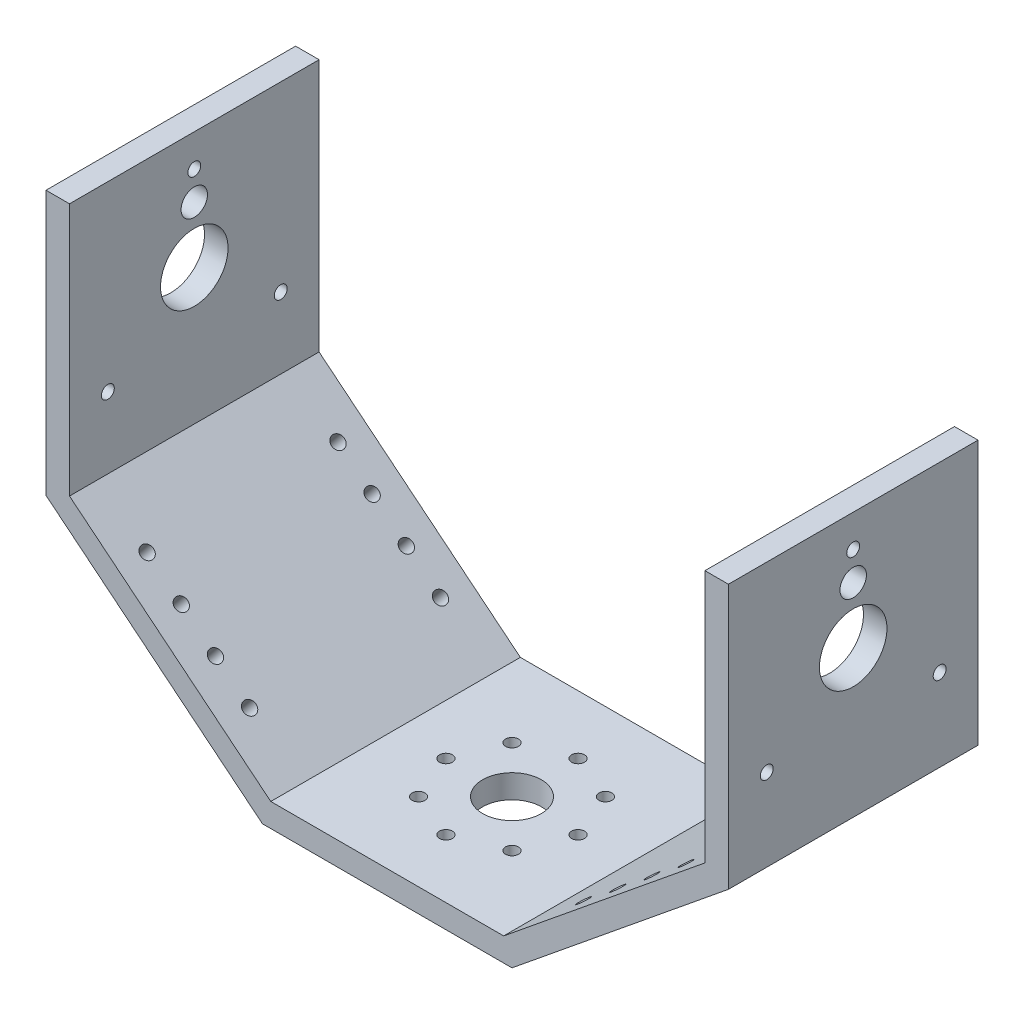
from build123d import *

# Parameters (mm, degrees)
SKETCH1_W           = 232.4
SKETCH1_H           = 85
BOSS_EXTRUDE1_DEPTH = 150
CUT_EXTRUDE1_DEPTH  = 150
CUT_EXTRUDE2_DEPTH  = 150
SKETCH4_R           = 11.5
SKETCH4_R_2         = 2.2
SKETCH4_R_3         = 4.5
CUT_EXTRUDE3_DEPTH  = 280.849977667
SKETCH5_R           = 10
SKETCH5_R_2         = 2.2
CUT_EXTRUDE4_DEPTH  = 189.341949655
SKETCH6_R           = 2.2
CUT_EXTRUDE5_DEPTH  = 221.699143461


with BuildPart() as part:
    # Sketch1 → Boss-Extrude1 (new body)
    with BuildSketch(Plane(origin=(0, 0, 0), x_dir=(1, 0, 0), z_dir=(0, 1, 0))):
        Rectangle(SKETCH1_W, SKETCH1_H)
    extrude(amount=BOSS_EXTRUDE1_DEPTH)

    # Sketch2 → Cut-Extrude1 (cut)
    with BuildSketch(Plane.XY.offset(42.5)):
        Polygon((-116.2, 0), (-116.2, 60), (-42.5, 0), align=None)
        Polygon((116.2, 60), (42.5, 0), (116.2, 0), align=None)
    extrude(amount=-CUT_EXTRUDE1_DEPTH, mode=Mode.SUBTRACT)

    # Sketch3 → Cut-Extrude2 (cut)
    with BuildSketch(Plane.XY.offset(42.5)):
        Polygon((-108.2, 142), (-108.2, 150), (108.2, 150), (108.2, 142), (108.2, 63.803007219), (39.655306133, 8), (-39.655306133, 8), (-108.2, 63.803007219), align=None)
    extrude(amount=-CUT_EXTRUDE2_DEPTH, mode=Mode.SUBTRACT)

    # Sketch4 → Cut-Extrude3 (cut, through all)
    with BuildSketch(Plane.ZY.offset(116.2)):
        with Locations((0, 110)):
            Circle(SKETCH4_R)
        with Locations((0, 139)):
            Circle(SKETCH4_R_2)
        with Locations((0, 129.25)):
            Circle(SKETCH4_R_3)
        with Locations((29.444863729, 88)):
            Circle(SKETCH4_R_2)
        with Locations((-29.444863729, 88)):
            Circle(SKETCH4_R_2)
    extrude(amount=-CUT_EXTRUDE3_DEPTH, mode=Mode.SUBTRACT)

    # Sketch5 → Cut-Extrude4 (cut, through all)
    with BuildSketch(Plane(origin=(0, 8, 0), x_dir=(1, 0, 0), z_dir=(0, 1, 0))):
        with Locations(Location((0, 0, 0), (0, 0, 270))):
            Circle(SKETCH5_R)
        with Locations(Location((0, 22.5, 0), (0, 0, 270))):
            Circle(SKETCH5_R_2)
        with Locations(Location((15.909902577, 15.909902577, 0), (0, 0, 270))):
            Circle(SKETCH5_R_2)
        with Locations(Location((22.5, 0, 0), (0, 0, 270))):
            Circle(SKETCH5_R_2)
        with Locations(Location((15.909902577, -15.909902577, 0), (0, 0, 270))):
            Circle(SKETCH5_R_2)
        with Locations(Location((0, -22.5, 0), (0, 0, 270))):
            Circle(SKETCH5_R_2)
        with Locations(Location((-15.909902577, -15.909902577, 0), (0, 0, 270))):
            Circle(SKETCH5_R_2)
        with Locations(Location((-22.5, 0, 0), (0, 0, 270))):
            Circle(SKETCH5_R_2)
        with Locations(Location((-15.909902577, 15.909902577, 0), (0, 0, 270))):
            Circle(SKETCH5_R_2)
    extrude(amount=-CUT_EXTRUDE4_DEPTH, mode=Mode.SUBTRACT)

    # Sketch6 → Cut-Extrude5 (cut, through all)
    with BuildSketch(Plane(origin=(-16.940351141, -20.808397985, 0), x_dir=(0.7755020970674419, -0.631344990828311, 0), z_dir=(-0.631344990828311, -0.7755020970674419, 0))):
        with Locations((-102.994043129, 32.5)):
            Circle(SKETCH6_R)
        with Locations((-87.994043129, 32.5)):
            Circle(SKETCH6_R)
        with Locations((-72.994043129, 32.5)):
            Circle(SKETCH6_R)
        with Locations((-57.994043129, 32.5)):
            Circle(SKETCH6_R)
        with Locations((-57.994043129, -32.5)):
            Circle(SKETCH6_R)
        with Locations((-72.994043129, -32.5)):
            Circle(SKETCH6_R)
        with Locations((-87.994043129, -32.5)):
            Circle(SKETCH6_R)
        with Locations((-102.994043129, -32.5)):
            Circle(SKETCH6_R)
    cut_extrude5 = extrude(amount=-CUT_EXTRUDE5_DEPTH, mode=Mode.SUBTRACT)

    # Mirror1: Cut-Extrude5 across plane
    add(cut_extrude5.mirror(Plane(origin=(0, 0, 0), x_dir=(0, 0, 1), z_dir=(1, 0, 0))), mode=Mode.SUBTRACT)


solid = part.part
